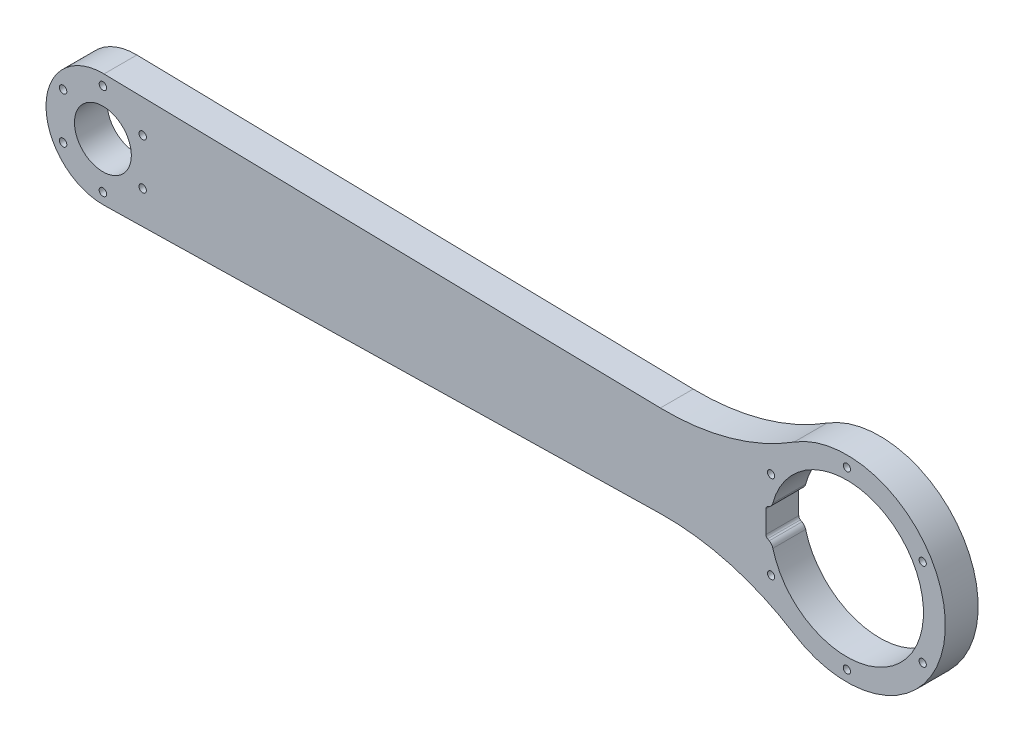
from build123d import *

# Parameters (mm, degrees)
SKETCH_1_R      = 1.65
SKETCH_1_R_2    = 13
SKETCH_1_R_3    = 1.7
EXTRUDE_1_DEPTH = 15


with BuildPart() as part:
    # 草图1 → 凸台-拉伸1 (new body)
    with BuildSketch(Plane.XY):
        with BuildLine():
            Line((-85.245113537, 20.900392521), (-339.479111624, 25.994781694))
            ThreePointArc((-339.479111624, 25.994781694), (-366, 0), (-339.479111624, -25.994781694))
            Line((-339.479111624, -25.994781694), (-85.245113537, -20.900392521))
            ThreePointArc((-85.245113537, -20.900392521), (-53.416829007, -24.942544633), (-24.108780491, -37.996930182))
            ThreePointArc((-24.108780491, -37.996930182), (45, 0), (-24.108780491, 37.996930182))
            ThreePointArc((-24.108780491, 37.996930182), (-53.416829007, 24.942544633), (-85.245113537, 20.900392521))
        make_face()
        with Locations((0, 40)):
            Circle(SKETCH_1_R, mode=Mode.SUBTRACT)
        with Locations((34.641016151, 20)):
            Circle(SKETCH_1_R, mode=Mode.SUBTRACT)
        with Locations((34.641016151, -20)):
            Circle(SKETCH_1_R, mode=Mode.SUBTRACT)
        with Locations((0, -40)):
            Circle(SKETCH_1_R, mode=Mode.SUBTRACT)
        with Locations((-34.641016151, 20)):
            Circle(SKETCH_1_R, mode=Mode.SUBTRACT)
        with Locations((-34.641016151, -20)):
            Circle(SKETCH_1_R, mode=Mode.SUBTRACT)
        with Locations((-340, 0)):
            Circle(SKETCH_1_R_2, mode=Mode.SUBTRACT)
        with Locations((-340, 21)):
            Circle(SKETCH_1_R_3, mode=Mode.SUBTRACT)
        with Locations((-358.186533479, 10.5)):
            Circle(SKETCH_1_R_3, mode=Mode.SUBTRACT)
        with Locations((-358.186533479, -10.5)):
            Circle(SKETCH_1_R_3, mode=Mode.SUBTRACT)
        with Locations((-340, -21)):
            Circle(SKETCH_1_R_3, mode=Mode.SUBTRACT)
        with Locations((-321.813466521, -10.5)):
            Circle(SKETCH_1_R_3, mode=Mode.SUBTRACT)
        with Locations((-321.813466521, 10.5)):
            Circle(SKETCH_1_R_3, mode=Mode.SUBTRACT)
        with BuildLine():
            Line((-35.500051413, 6.790401018), (-36.237951224, 6.373427606))
            ThreePointArc((-36.237951224, 6.373427606), (-36.795555255, 5.823507629), (-37, 5.067507244))
            Line((-37, 5.067507244), (-37, -5.067507244))
            ThreePointArc((-37, -5.067507244), (-36.795555255, -5.823507629), (-36.237951224, -6.373427606))
            Line((-36.237951224, -6.373427606), (-35.500051413, -6.790401018))
            ThreePointArc((-35.500051413, -6.790401018), (-34.451431588, -7.698788042), (-33.838125094, -8.943225935))
            ThreePointArc((-33.838125094, -8.943225935), (35, 0), (-33.838125094, 8.943225935))
            ThreePointArc((-33.838125094, 8.943225935), (-34.451431588, 7.698788042), (-35.500051413, 6.790401018))
        make_face(mode=Mode.SUBTRACT)
    extrude(amount=EXTRUDE_1_DEPTH)


solid = part.part
